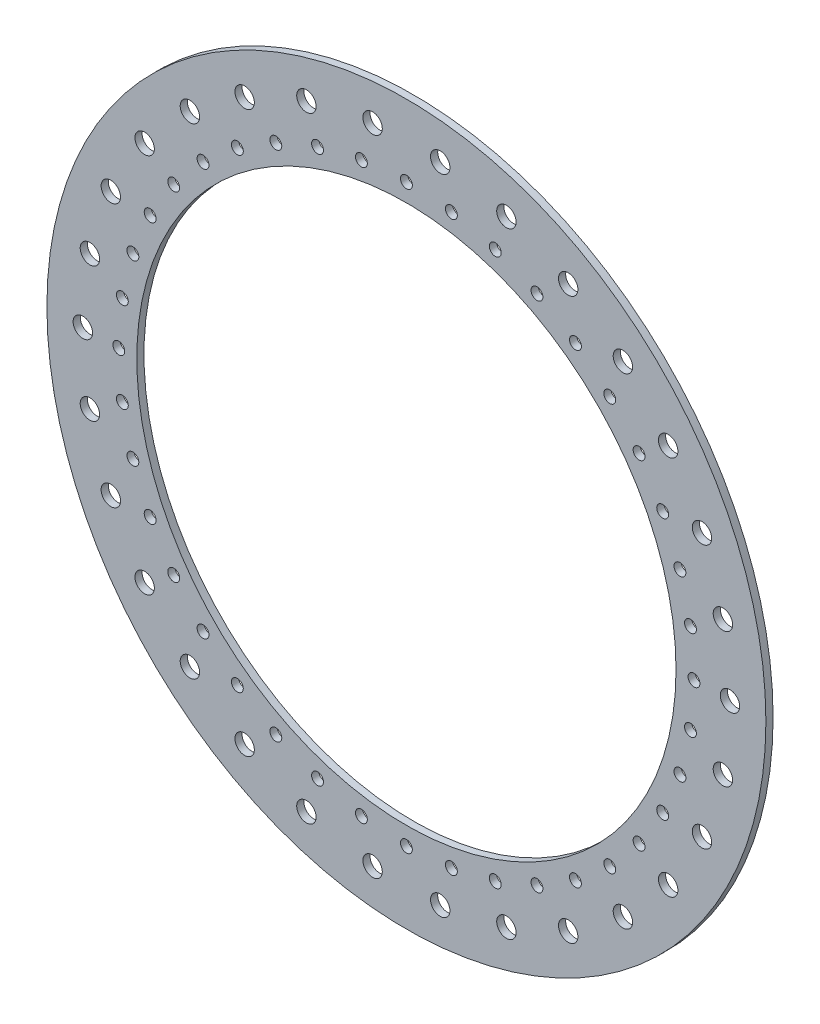
from build123d import *

# Parameters (mm, degrees)
CROQUIS1_R                   = 200
CROQUIS1_R_2                 = 150
CROQUIS1_R_3                 = 5.4
SALIENTE_EXTRUIR1_DEPTH      = 4
TALADRO_DE_MARGEN_PARA_M61_D = 6.6


with BuildPart() as part:
    # Croquis1 → Saliente-Extruir1 (new body)
    with BuildSketch(Plane.XY):
        Circle(CROQUIS1_R)
        Circle(CROQUIS1_R_2, mode=Mode.SUBTRACT)
        with Locations((145.623058987, 105.801345413)):
            Circle(CROQUIS1_R_3, mode=Mode.SUBTRACT)
        with Locations((164.438182376, 73.212595754)):
            Circle(CROQUIS1_R_3, mode=Mode.SUBTRACT)
        with Locations((176.066568132, 37.424104347)):
            Circle(CROQUIS1_R_3, mode=Mode.SUBTRACT)
        with Locations((180, 0)):
            Circle(CROQUIS1_R_3, mode=Mode.SUBTRACT)
        with Locations((176.066568132, -37.424104347)):
            Circle(CROQUIS1_R_3, mode=Mode.SUBTRACT)
        with Locations((164.438182376, -73.212595754)):
            Circle(CROQUIS1_R_3, mode=Mode.SUBTRACT)
        with Locations((145.623058987, -105.801345413)):
            Circle(CROQUIS1_R_3, mode=Mode.SUBTRACT)
        with Locations((120.443509145, -133.766068586)):
            Circle(CROQUIS1_R_3, mode=Mode.SUBTRACT)
        with Locations((90, -155.884572681)):
            Circle(CROQUIS1_R_3, mode=Mode.SUBTRACT)
        with Locations((55.623058987, -171.190172933)):
            Circle(CROQUIS1_R_3, mode=Mode.SUBTRACT)
        with Locations((18.815123388, -179.013941166)):
            Circle(CROQUIS1_R_3, mode=Mode.SUBTRACT)
        with Locations((-18.815123388, -179.013941166)):
            Circle(CROQUIS1_R_3, mode=Mode.SUBTRACT)
        with Locations((-55.623058987, -171.190172933)):
            Circle(CROQUIS1_R_3, mode=Mode.SUBTRACT)
        with Locations((-90, -155.884572681)):
            Circle(CROQUIS1_R_3, mode=Mode.SUBTRACT)
        with Locations((-120.443509145, -133.766068586)):
            Circle(CROQUIS1_R_3, mode=Mode.SUBTRACT)
        with Locations((-145.623058987, -105.801345413)):
            Circle(CROQUIS1_R_3, mode=Mode.SUBTRACT)
        with Locations((-164.438182376, -73.212595754)):
            Circle(CROQUIS1_R_3, mode=Mode.SUBTRACT)
        with Locations((-176.066568132, -37.424104347)):
            Circle(CROQUIS1_R_3, mode=Mode.SUBTRACT)
        with Locations((-180, 0)):
            Circle(CROQUIS1_R_3, mode=Mode.SUBTRACT)
        with Locations((-176.066568132, 37.424104347)):
            Circle(CROQUIS1_R_3, mode=Mode.SUBTRACT)
        with Locations((-164.438182376, 73.212595754)):
            Circle(CROQUIS1_R_3, mode=Mode.SUBTRACT)
        with Locations((-145.623058987, 105.801345413)):
            Circle(CROQUIS1_R_3, mode=Mode.SUBTRACT)
        with Locations((-120.443509145, 133.766068586)):
            Circle(CROQUIS1_R_3, mode=Mode.SUBTRACT)
        with Locations((-90, 155.884572681)):
            Circle(CROQUIS1_R_3, mode=Mode.SUBTRACT)
        with Locations((-55.623058987, 171.190172933)):
            Circle(CROQUIS1_R_3, mode=Mode.SUBTRACT)
        with Locations((-18.815123388, 179.013941166)):
            Circle(CROQUIS1_R_3, mode=Mode.SUBTRACT)
        with Locations((18.815123388, 179.013941166)):
            Circle(CROQUIS1_R_3, mode=Mode.SUBTRACT)
        with Locations((55.623058987, 171.190172933)):
            Circle(CROQUIS1_R_3, mode=Mode.SUBTRACT)
        with Locations((90, 155.884572681)):
            Circle(CROQUIS1_R_3, mode=Mode.SUBTRACT)
        with Locations((120.443509145, 133.766068586)):
            Circle(CROQUIS1_R_3, mode=Mode.SUBTRACT)
    extrude(amount=SALIENTE_EXTRUIR1_DEPTH)

    # Taladro de margen para M61 (through all)
    with Locations(Plane(origin=(-113.13708499, 113.13708499, 0), x_dir=(-1, 0, 0), z_dir=(0, 0, -1))):
        with Locations((0, 0), (-19.091444623, 16.30563411), (-40.498605032, 29.42395888), (-63.69436589, 39.031957617), (16.30563411, -19.091444623), (29.42395888, -40.498605032), (39.031957617, -63.69436589), (44.893049505, -88.107570584), (46.86291501, -113.13708499), (44.893049505, -138.166599396), (39.031957617, -162.57980409), (29.42395888, -185.775564948), (16.30563411, -207.182725357), (0, -226.27416998), (-19.091444623, -242.57980409), (-40.498605032, -255.69812886), (-63.69436589, -265.306127597), (-88.107570584, -271.167219485), (-113.13708499, -273.13708499), (-138.166599396, -271.167219485), (-162.57980409, -265.306127597), (-185.775564948, -255.69812886), (-207.182725357, -242.57980409), (-226.27416998, -226.27416998), (-242.57980409, -207.182725357), (-255.69812886, -185.775564948), (-265.306127597, -162.57980409), (-271.167219485, -138.166599396), (-273.13708499, -113.13708499), (-271.167219485, -88.107570584), (-265.306127597, -63.69436589), (-255.69812886, -40.498605032), (-242.57980409, -19.091444623), (-226.27416998, 0), (-207.182725357, 16.30563411), (-185.775564948, 29.42395888), (-162.57980409, 39.031957617), (-138.166599396, 44.893049505), (-113.13708499, 46.86291501), (-88.107570584, 44.893049505)):
            Hole(TALADRO_DE_MARGEN_PARA_M61_D / 2)


solid = part.part
